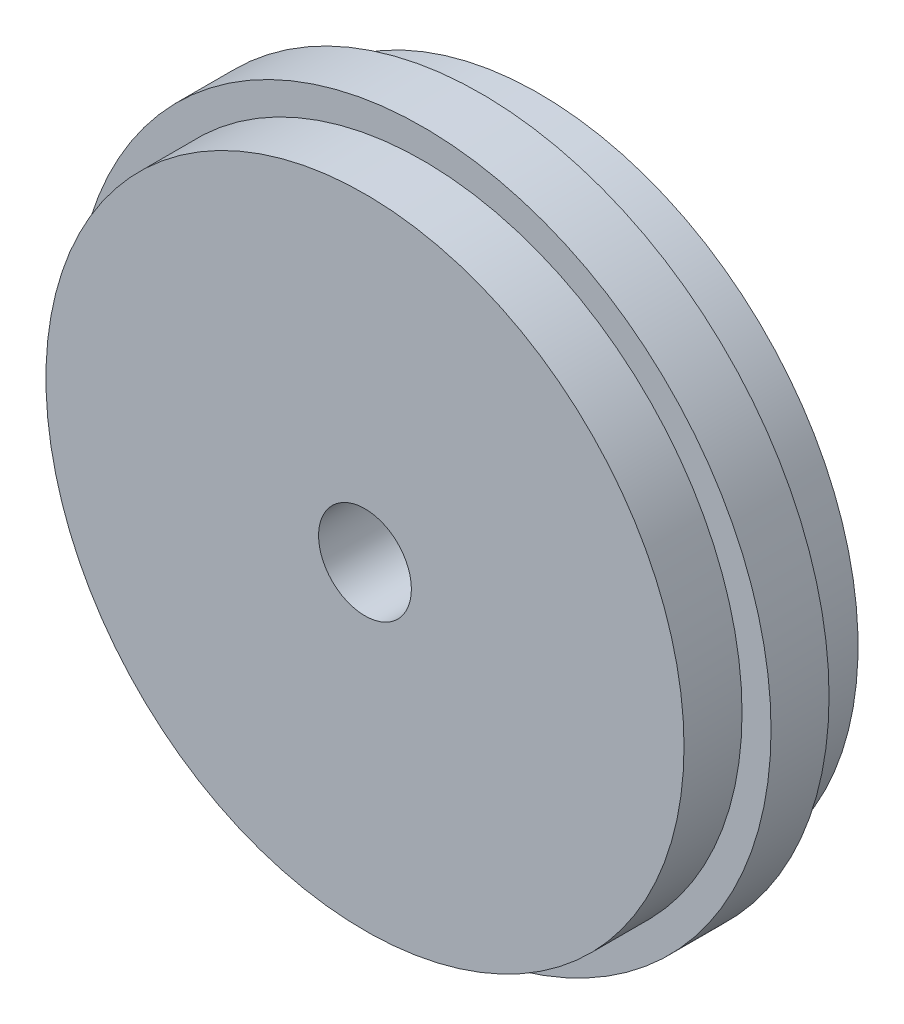
from build123d import *

# Parameters (mm, degrees)
SKETCH1_R           = 60
BOSS_EXTRUDE1_DEPTH = 10
SKETCH2_R           = 55
BOSS_EXTRUDE2_DEPTH = 10
BOSS_EXTRUDE4_START = 10
SKETCH5_R           = 55
BOSS_EXTRUDE4_DEPTH = 10
SKETCH3_R           = 8
CUT_EXTRUDE2_DEPTH  = 91


with BuildPart() as part:
    # Sketch1 → Boss-Extrude1 (new body)
    with BuildSketch(Plane.XY):
        Circle(SKETCH1_R)
    extrude(amount=BOSS_EXTRUDE1_DEPTH)

    # Sketch2 → Boss-Extrude2 (add)
    with BuildSketch(Plane.XY.offset(10)):
        Circle(SKETCH2_R)
    extrude(amount=BOSS_EXTRUDE2_DEPTH)

    # Sketch5 → Boss-Extrude4 (add)
    with BuildSketch(Plane(origin=(0, 0, 0), x_dir=(-1, 0, 0), z_dir=(0, 0, -1)).offset(BOSS_EXTRUDE4_START)):
        with Locations(Location((0, 0, 0), (0, 0, 180))):
            Circle(SKETCH5_R)
    extrude(amount=-BOSS_EXTRUDE4_DEPTH)

    # Sketch3 → Cut-Extrude2 (cut, through all)
    with BuildSketch(Plane.XY.offset(20)):
        Circle(SKETCH3_R)
    extrude(amount=-CUT_EXTRUDE2_DEPTH, mode=Mode.SUBTRACT)


solid = part.part
